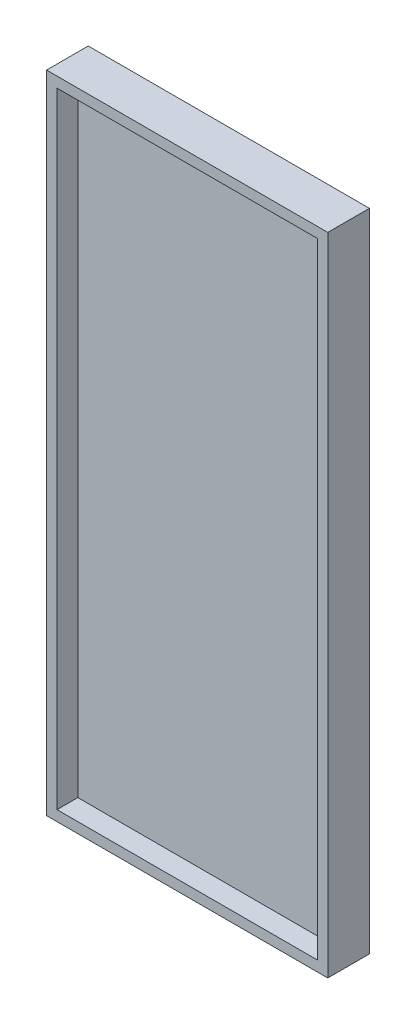
from build123d import *

# Parameters (mm, degrees)
SKETCH1_W           = 27
SKETCH1_H           = 62
BOSS_EXTRUDE1_DEPTH = 2
SKETCH6_W           = 27
SKETCH6_H           = 62
SKETCH6_W_2         = 25
SKETCH6_H_2         = 60
BOSS_EXTRUDE2_DEPTH = 2


with BuildPart() as part:
    # Sketch1 → Boss-Extrude1 (new body)
    with BuildSketch(Plane.XY):
        Rectangle(SKETCH1_W, SKETCH1_H)
    extrude(amount=BOSS_EXTRUDE1_DEPTH)

    # Sketch6 → Boss-Extrude2 (add)
    with BuildSketch(Plane.XY.offset(2)):
        Rectangle(SKETCH6_W, SKETCH6_H)
        Rectangle(SKETCH6_W_2, SKETCH6_H_2, mode=Mode.SUBTRACT)
    extrude(amount=BOSS_EXTRUDE2_DEPTH)


solid = part.part
